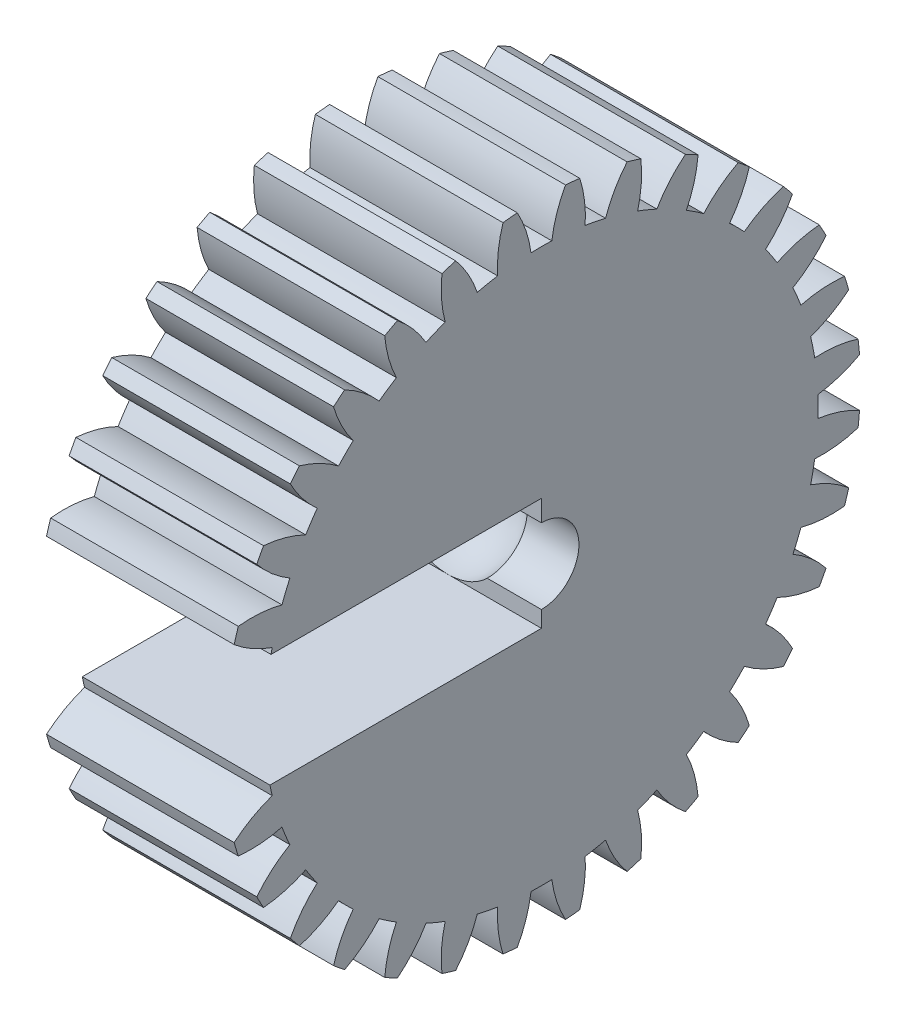
from build123d import *

# Parameters (mm, degrees)
BASPROSKE_W             = 5
BASPROSKE_H             = 8.5
TOOTHCUT_DEPTH          = 14.019216566
TEETHCUTS_COUNT         = 32
TEETHCUTS_ANGLE         = 348.75
BORSKE_R                = 1
BORE_DEPTH              = 50.0000508
CUT_EXTRUDE1_DEPTH      = 13.987467398
CUT_EXTRUDE1_DEPTH_BACK = 13.987467398
SKETCH1_W               = 10
SKETCH1_H               = 3


with BuildPart() as part:
    # BasProSke → Base-Revolve (revolve)
    with BuildSketch(Plane(origin=(0, 0, 0), x_dir=(1, 0, 0), z_dir=(0, 1, 0)), mode=Mode.PRIVATE) as base_revolve_sk:
        with Locations((2.5, 4.25)):
            Rectangle(BASPROSKE_W, BASPROSKE_H)
    revolve(base_revolve_sk.sketch.rotate(Axis((-10, 0, 0), (1, 0, 0)), 180), axis=Axis((-10, 0, 0), (1, 0, 0)))

    # TooCutSke → ToothCut (cut, through all)
    with BuildSketch(Plane(origin=(0, 0, 0), x_dir=(0, 0, -1), z_dir=(1, 0, 0))):
        with BuildLine():
            ThreePointArc((0.277002447, 7.3687954), (0, 7.374), (-0.277002447, 7.3687954))
            ThreePointArc((-0.277002447, 7.3687954), (-0.41335061, 7.952280695), (-0.656086882, 8.500117362))
            ThreePointArc((-0.656086882, 8.500117362), (0, 8.5254), (0.656086882, 8.500117362))
            ThreePointArc((0.656086882, 8.500117362), (0.41335061, 7.952280695), (0.277002447, 7.3687954))
        make_face()
    toothcut = extrude(amount=TOOTHCUT_DEPTH, mode=Mode.SUBTRACT)

    # TeethCuts: ToothCut ×32 about axis
    teethcuts_axis = Axis((-10, 0, 0), (1, 0, 0))
    for i in range(1, TEETHCUTS_COUNT):
        add(toothcut.rotate(teethcuts_axis, i * TEETHCUTS_ANGLE / (TEETHCUTS_COUNT - 1)), mode=Mode.SUBTRACT)

    # BorSke → Bore (cut, symmetric)
    with BuildSketch(Plane(origin=(0, 0, 0), x_dir=(0, 0, -1), z_dir=(1, 0, 0))):
        with Locations(Location((0, 0, 0), (0, 0, 180))):
            Circle(BORSKE_R)
    extrude(amount=BORE_DEPTH, both=True, mode=Mode.SUBTRACT)

    # Sketch1 → Cut-Extrude1 (cut, two sides: drawn at the far end of the back side and taken through both)
    with BuildSketch(Plane(origin=(5, 0, 0), x_dir=(0, 0, -1), z_dir=(1, 0, 0)).offset(-CUT_EXTRUDE1_DEPTH_BACK)):
        with Locations((-5, 0.065617364)):
            Rectangle(SKETCH1_W, SKETCH1_H)
    extrude(amount=CUT_EXTRUDE1_DEPTH + CUT_EXTRUDE1_DEPTH_BACK, mode=Mode.SUBTRACT)

    # Sketch7 → Cut-Revolve2 (revolve, cut)
    with BuildSketch(Plane(origin=(0, 0.065617364, 0), x_dir=(1, 0, 0), z_dir=(0, 1, 0))):
        with BuildLine():
            ThreePointArc((1, 0), (2.5, 1.5), (4, 0))
            Line((4, 0), (1, 0))
        make_face()
    revolve(axis=Axis((4, 0.065617364, 0), (-1, 0, 0)), mode=Mode.SUBTRACT)


solid = part.part
